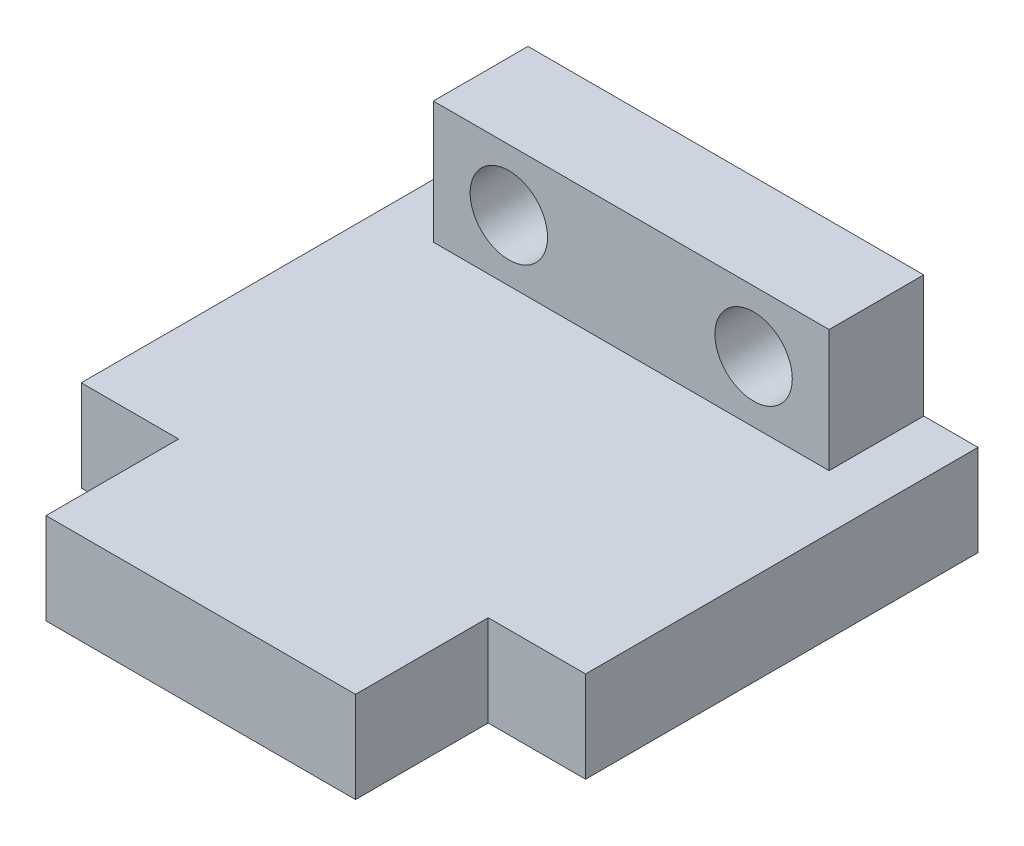
from build123d import *

# Parameters (mm, degrees)
SKETCH_1_W          = 22.81
SKETCH_1_H          = 17.75
EXTRUDE_1_DEPTH     = 1.06
SKETCH_2_W          = 1.44
SKETCH_2_H          = 3.065036756
EXTRUDE_2_DEPTH     = 6.92
EXTRUDE_3_DEPTH     = 3.065036756
SKETCH_4_R          = 2.925
EXTRUDE_4_DEPTH     = 5.85
SKETCH_5_W          = 22.81
SKETCH_5_H          = 4.28
EXTRUDE_5_DEPTH     = 5.53
SKETCH_6_R          = 1.75
CUT_EXTRUDE_1_DEPTH = 5.53
SKETCH_7_W          = 14
SKETCH_7_H          = 6
EXTRUDE_6_DEPTH     = 4.125036756
CUT_EXTRUDE_START   = -4
SKETCH_8_R          = 2.925
CUT_EXTRUDE_2_DEPTH = 4
EXTRUDE_START       = -1.85
EXTRUDE_7_DEPTH     = 1.85
SKETCH_10_W         = 2.455
SKETCH_10_H         = 4.28
CUT_EXTRUDE_3_DEPTH = 5.53


with BuildPart() as part:
    # 草图1 → 凸台-拉伸1 (new body)
    with BuildSketch(Plane(origin=(0, 0, 0), x_dir=(1, 0, 0), z_dir=(0, 1, 0))):
        Rectangle(SKETCH_1_W, SKETCH_1_H)
    extrude(amount=EXTRUDE_1_DEPTH)

    # 草图2 → 凸台-拉伸2 (add)
    with BuildSketch(Plane(origin=(0, 0, -8.875), x_dir=(-1, 0, 0), z_dir=(0, 0, -1))):
        with Locations((-10.685, -1.532518378)):
            Rectangle(SKETCH_2_W, SKETCH_2_H)
        with Locations((10.685, -1.532518378)):
            Rectangle(SKETCH_2_W, SKETCH_2_H)
    extrude(amount=-EXTRUDE_2_DEPTH)

    # 草图3 → 凸台-拉伸3 (add)
    with BuildSketch(Plane.XZ):
        Polygon((-11.405, 8.875), (-11.405, -1.955), (-9.965, -1.955), (9.965, -1.955), (11.405, -1.955), (11.405, 8.875), align=None)
    extrude(amount=EXTRUDE_3_DEPTH)

    # 草图4 → 凸台-拉伸4 (add)
    with BuildSketch(Plane.XZ.offset(3.065036756)):
        with Locations(Location((-4.93, 3.75, 0), (0, 0, 270))):
            Circle(SKETCH_4_R)
        with Locations(Location((4.93, 3.75, 0), (0, 0, 270))):
            Circle(SKETCH_4_R)
    extrude(amount=EXTRUDE_4_DEPTH)

    # 草图5 → 凸台-拉伸5 (add)
    with BuildSketch(Plane(origin=(0, 1.06, 0), x_dir=(1, 0, 0), z_dir=(0, 1, 0))):
        with Locations((0, 6.735)):
            Rectangle(SKETCH_5_W, SKETCH_5_H)
    extrude(amount=EXTRUDE_5_DEPTH)

    # 草图6 → 切除-拉伸1 (cut)
    with BuildSketch(Plane.XY.offset(-4.595)):
        with Locations((5.535, 3.825)):
            Circle(SKETCH_6_R)
        with Locations((-5.535, 3.825)):
            Circle(SKETCH_6_R)
    extrude(amount=-CUT_EXTRUDE_1_DEPTH, mode=Mode.SUBTRACT)

    # 草图7 → 凸台-拉伸6 (add)
    with BuildSketch(Plane(origin=(0, 1.06, 0), x_dir=(1, 0, 0), z_dir=(0, 1, 0))):
        with Locations((0, -11.875)):
            Rectangle(SKETCH_7_W, SKETCH_7_H)
    extrude(amount=-EXTRUDE_6_DEPTH)

    # 草图8 → 切除-拉伸2 (cut)
    with BuildSketch(Plane.XZ.offset(8.915036756).offset(CUT_EXTRUDE_START)):
        with Locations(Location((-4.93, 3.75, 0), (0, 0, 270))):
            Circle(SKETCH_8_R)
        with Locations(Location((4.93, 3.75, 0), (0, 0, 270))):
            Circle(SKETCH_8_R)
    extrude(amount=CUT_EXTRUDE_2_DEPTH, mode=Mode.SUBTRACT)

    # 草图9 → 凸台-拉伸7 (add)
    with BuildSketch(Plane.XZ.offset(4.915036756).offset(EXTRUDE_START)):
        with BuildLine():
            ThreePointArc((-7.855, 3.75), (-6.998287335, 5.818287335), (-4.93, 6.675))
            Line((-4.93, 6.675), (-7.855, 6.675))
            Line((-7.855, 6.675), (-7.855, 3.75))
        make_face()
        with BuildLine():
            Line((-7.855, 0.825), (-4.93, 0.825))
            ThreePointArc((-4.93, 0.825), (-6.998287335, 1.681712665), (-7.855, 3.75))
            Line((-7.855, 3.75), (-7.855, 0.825))
        make_face()
        with BuildLine():
            Line((-2.005, 0.825), (-2.005, 3.75))
            ThreePointArc((-2.005, 3.75), (-2.861712665, 1.681712665), (-4.93, 0.825))
            Line((-4.93, 0.825), (-2.005, 0.825))
        make_face()
        with BuildLine():
            ThreePointArc((-4.93, 6.675), (-2.861712665, 5.818287335), (-2.005, 3.75))
            Line((-2.005, 3.75), (-2.005, 6.675))
            Line((-2.005, 6.675), (-4.93, 6.675))
        make_face()
        with BuildLine():
            ThreePointArc((2.005, 3.75), (2.861712665, 5.818287335), (4.93, 6.675))
            Line((4.93, 6.675), (2.005, 6.675))
            Line((2.005, 6.675), (2.005, 3.75))
        make_face()
        with BuildLine():
            ThreePointArc((4.93, 0.825), (2.861712665, 1.681712665), (2.005, 3.75))
            Line((2.005, 3.75), (2.005, 0.825))
            Line((2.005, 0.825), (4.93, 0.825))
        make_face()
        with BuildLine():
            Line((7.855, 0.825), (7.855, 3.75))
            ThreePointArc((7.855, 3.75), (6.998287335, 1.681712665), (4.93, 0.825))
            Line((4.93, 0.825), (7.855, 0.825))
        make_face()
        with BuildLine():
            Line((7.855, 6.675), (4.93, 6.675))
            ThreePointArc((4.93, 6.675), (6.998287335, 5.818287335), (7.855, 3.75))
            Line((7.855, 3.75), (7.855, 6.675))
        make_face()
    extrude(amount=EXTRUDE_7_DEPTH)

    # 草图10 → 切除-拉伸3 (cut)
    with BuildSketch(Plane(origin=(0, 6.59, 0), x_dir=(1, 0, 0), z_dir=(0, 1, 0))):
        with Locations((-10.1775, 6.735)):
            Rectangle(SKETCH_10_W, SKETCH_10_H)
        with Locations((10.1775, 6.735)):
            Rectangle(SKETCH_10_W, SKETCH_10_H)
    extrude(amount=-CUT_EXTRUDE_3_DEPTH, mode=Mode.SUBTRACT)


solid = part.part
